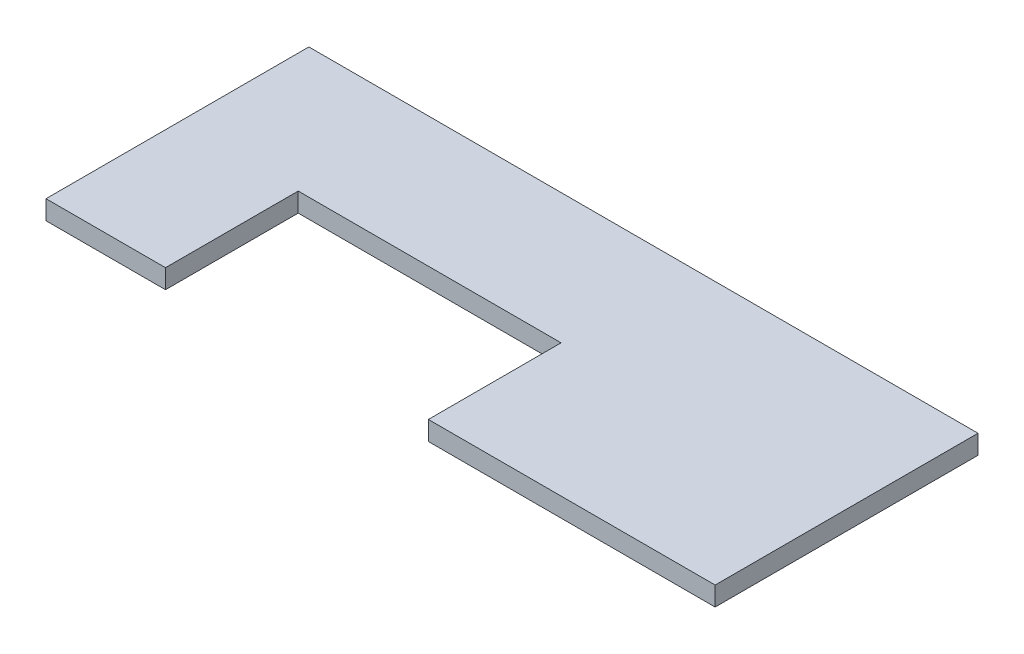
from build123d import *

# Parameters (mm, degrees)
BOSS_EXTRUDE1_DEPTH = 4


with BuildPart() as part:
    # Sketch2 → Boss-Extrude1 (new body)
    with BuildSketch(Plane(origin=(0, 0, 0), x_dir=(1, 0, 0), z_dir=(0, 1, 0))):
        Polygon((-196.239669421, 90.289256198), (-56.239669421, 90.289256198), (-56.239669421, 35.289256198), (-116.239669421, 35.289256198), (-116.239669421, 63.05785124), (-171.239669421, 63.05785124), (-171.239669421, 35.289256198), (-196.239669421, 35.289256198), align=None)
    extrude(amount=BOSS_EXTRUDE1_DEPTH)


solid = part.part
